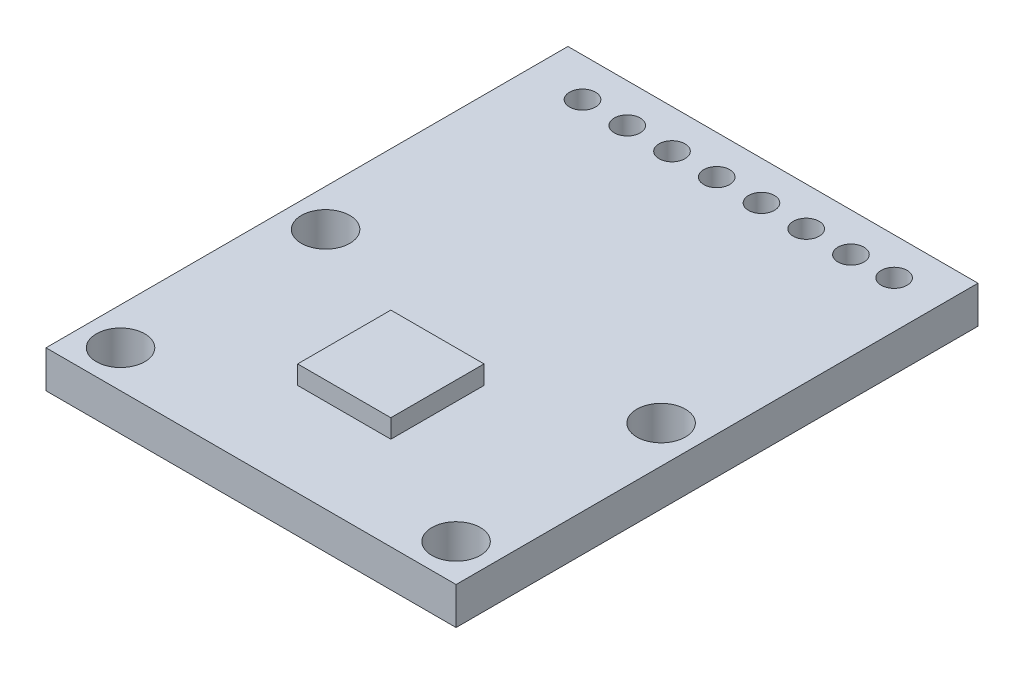
from build123d import *

# Parameters (mm, degrees)
SKETCH2_W          = 22
SKETCH2_H          = 28
SKETCH2_R          = 1.3
MAINBODY_DEPTH     = 2
SKETCH3_W          = 5
SKETCH3_H          = 5
CHIP_DEPTH         = 1
SKETCH4_R          = 0.695578212
CUT_EXTRUDE1_DEPTH = 18.916472867


with BuildPart() as part:
    # Sketch2 → MainBody (new body)
    with BuildSketch(Plane(origin=(0, 0, 0), x_dir=(1, 0, 0), z_dir=(0, 1, 0))):
        Rectangle(SKETCH2_W, SKETCH2_H)
        with Locations(Location((9, -1, 0), (0, 0, 270))):
            Circle(SKETCH2_R, mode=Mode.SUBTRACT)
        with Locations(Location((-9, -1, 0), (0, 0, 270))):
            Circle(SKETCH2_R, mode=Mode.SUBTRACT)
        with Locations(Location((-9, -12, 0), (0, 0, 270))):
            Circle(SKETCH2_R, mode=Mode.SUBTRACT)
        with Locations(Location((9, -12, 0), (0, 0, 270))):
            Circle(SKETCH2_R, mode=Mode.SUBTRACT)
    extrude(amount=MAINBODY_DEPTH)

    # Sketch3 → chip (add)
    with BuildSketch(Plane(origin=(0, 2, 0), x_dir=(1, 0, 0), z_dir=(0, 1, 0))):
        with Locations((0, -6.5)):
            Rectangle(SKETCH3_W, SKETCH3_H)
    extrude(amount=CHIP_DEPTH)

    # Sketch4 → Cut-Extrude1 (cut, through all)
    with BuildSketch(Plane(origin=(0, 2, 0), x_dir=(1, 0, 0), z_dir=(0, 1, 0))):
        with Locations(Location((-8.137841022, 11.921007347, 0), (0, 0, 270))):
            Circle(SKETCH4_R)
        with Locations(Location((8.5, 12, 0), (0, 0, 270))):
            Circle(SKETCH4_R)
        with Locations(Location((-5.737841022, 11.921007347, 0), (0, 0, 270))):
            Circle(SKETCH4_R)
        with Locations(Location((-3.337841022, 11.921007347, 0), (0, 0, 270))):
            Circle(SKETCH4_R)
        with Locations(Location((-0.937841022, 11.921007347, 0), (0, 0, 270))):
            Circle(SKETCH4_R)
        with Locations(Location((1.462158978, 11.921007347, 0), (0, 0, 270))):
            Circle(SKETCH4_R)
        with Locations(Location((3.862158978, 11.921007347, 0), (0, 0, 270))):
            Circle(SKETCH4_R)
        with Locations(Location((6.262158978, 11.921007347, 0), (0, 0, 270))):
            Circle(SKETCH4_R)
    extrude(amount=-CUT_EXTRUDE1_DEPTH, mode=Mode.SUBTRACT)


solid = part.part
